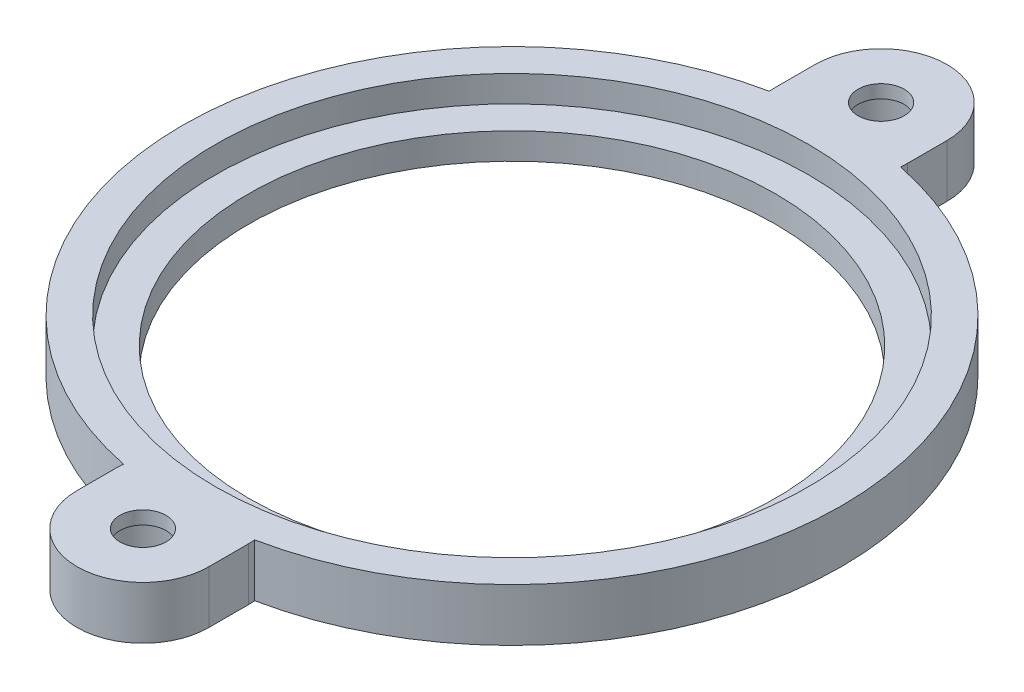
from build123d import *

# Parameters (mm, degrees)
BOSS_EXTRUDE1_DEPTH = 4
SKETCH2_R           = 20
CUT_EXTRUDE1_DEPTH  = 42.593268686
SKETCH3_R           = 22.5
CUT_EXTRUDE2_DEPTH  = 2
SKETCH4_R           = 1.75
CUT_EXTRUDE3_DEPTH  = 42.593268686
SKETCH5_R           = 3.25
CUT_EXTRUDE4_DEPTH  = 3


with BuildPart() as part:
    # Sketch1 → Boss-Extrude1 (new body)
    with BuildSketch(Plane(origin=(0, 0, 0), x_dir=(1, 0, 0), z_dir=(0, 1, 0))):
        with BuildLine():
            Line((-5, 25), (-5, 28))
            ThreePointArc((-5, 28), (0, 33), (5, 28))
            Line((5, 28), (5, 25))
            ThreePointArc((5, 25), (4.993730366, 24.749686125), (4.974937186, 24.5))
            ThreePointArc((4.974937186, 24.5), (25, 0), (4.974937186, -24.5))
            ThreePointArc((4.974937186, -24.5), (4.993730366, -24.749686125), (5, -25))
            Line((5, -25), (5, -28))
            ThreePointArc((5, -28), (0, -33), (-5, -28))
            Line((-5, -28), (-5, -25))
            ThreePointArc((-5, -25), (-4.993730366, -24.749686125), (-4.974937186, -24.5))
            ThreePointArc((-4.974937186, -24.5), (-25, 0), (-4.974937186, 24.5))
            ThreePointArc((-4.974937186, 24.5), (-4.993730366, 24.749686125), (-5, 25))
        make_face()
    extrude(amount=BOSS_EXTRUDE1_DEPTH)

    # Sketch2 → Cut-Extrude1 (cut, through all)
    with BuildSketch(Plane(origin=(0, 4, 0), x_dir=(1, 0, 0), z_dir=(0, 1, 0))):
        with Locations(Location((0, 0, 0), (0, 0, 270))):
            Circle(SKETCH2_R)
    extrude(amount=-CUT_EXTRUDE1_DEPTH, mode=Mode.SUBTRACT)

    # Sketch3 → Cut-Extrude2 (cut)
    with BuildSketch(Plane(origin=(0, 4, 0), x_dir=(1, 0, 0), z_dir=(0, 1, 0))):
        with Locations(Location((0, 0, 0), (0, 0, 270))):
            Circle(SKETCH3_R)
    extrude(amount=-CUT_EXTRUDE2_DEPTH, mode=Mode.SUBTRACT)

    # Sketch4 → Cut-Extrude3 (cut, through all)
    with BuildSketch(Plane(origin=(0, 4, 0), x_dir=(1, 0, 0), z_dir=(0, 1, 0))):
        with Locations(Location((0, -28, 0), (0, 0, 270))):
            Circle(SKETCH4_R)
        with Locations(Location((0, 28, 0), (0, 0, 90))):
            Circle(SKETCH4_R)
    extrude(amount=-CUT_EXTRUDE3_DEPTH, mode=Mode.SUBTRACT)

    # Sketch5 → Cut-Extrude4 (cut)
    with BuildSketch(Plane.XZ):
        with Locations(Location((0, 28, 0), (0, 0, 270))):
            Circle(SKETCH5_R)
        with Locations(Location((0, -28, 0), (0, 0, 90))):
            Circle(SKETCH5_R)
    extrude(amount=-CUT_EXTRUDE4_DEPTH, mode=Mode.SUBTRACT)


solid = part.part
